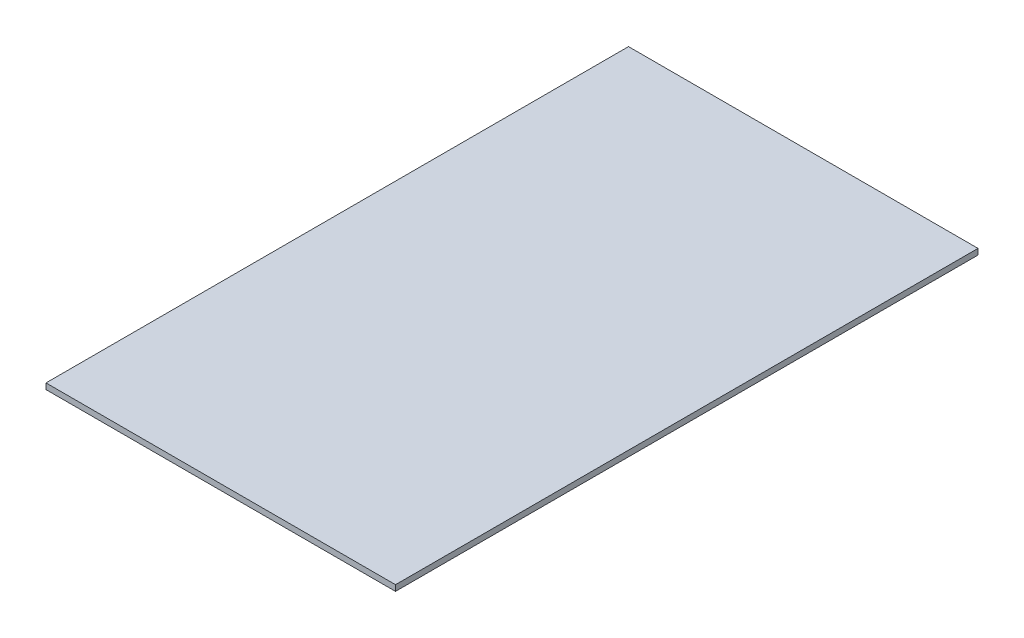
from build123d import *

# Parameters (mm, degrees)
SKETCH_1_W      = 1200
SKETCH_1_H      = 1200
EXTRUDE_1_DEPTH = 20
SKETCH_6_W      = 1200
SKETCH_6_H      = 800
EXTRUDE_3_DEPTH = 20
SCALE_1_SCALE   = 1.7


with BuildPart() as part:
    # 草图1 → 凸台-拉伸1 (new body)
    with BuildSketch(Plane(origin=(0, 0, 0), x_dir=(1, 0, 0), z_dir=(0, 1, 0))):
        Rectangle(SKETCH_1_W, SKETCH_1_H)
    extrude(amount=EXTRUDE_1_DEPTH)

    # 草图6 → 凸台-拉伸3 (add)
    with BuildSketch(Plane(origin=(0, 20, 0), x_dir=(1, 0, 0), z_dir=(0, 1, 0))):
        with Locations((0, -1000)):
            Rectangle(SKETCH_6_W, SKETCH_6_H)
    extrude(amount=-EXTRUDE_3_DEPTH)


with BuildPart() as part_1:
    # 缩放比例1: scaled about (0, 0, 0)
    add(part.part.scale(SCALE_1_SCALE))


solid = part_1.part
